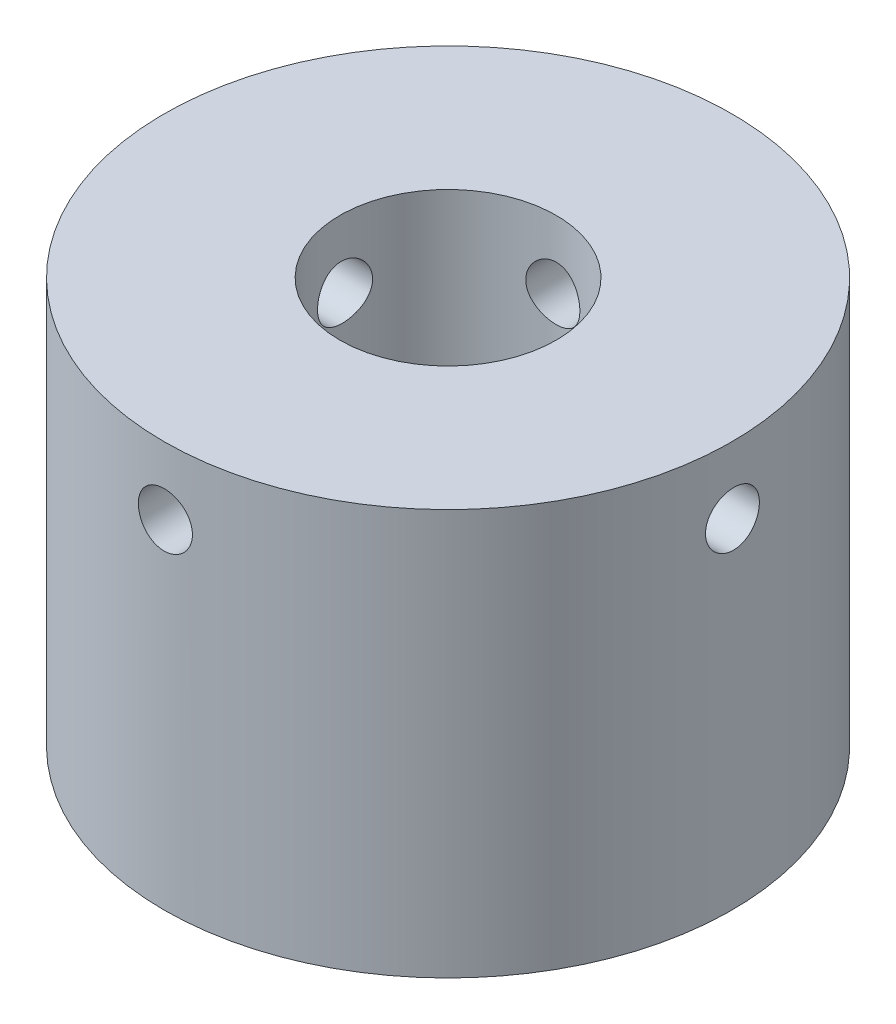
from build123d import *

# Parameters (mm, degrees)
CROQUIS1_R                 = 10.5
CROQUIS1_R_2               = 4
SALIENTE_EXTRUIR1_DEPTH    = 15
CORTAR_EXTRUIR1_DEPTH      = 15
CORTAR_EXTRUIR1_DEPTH_BACK = 15
CROQUIS2_R                 = 1
CORTAR_EXTRUIR2_DEPTH      = 15
CORTAR_EXTRUIR2_DEPTH_BACK = 15
CROQUIS3_R                 = 1.002014624


with BuildPart() as part:
    # Croquis1 → Saliente-Extruir1 (new body)
    with BuildSketch(Plane(origin=(0, 0, 0), x_dir=(1, 0, 0), z_dir=(0, 1, 0))):
        Circle(CROQUIS1_R)
        Circle(CROQUIS1_R_2, mode=Mode.SUBTRACT)
    extrude(amount=SALIENTE_EXTRUIR1_DEPTH)

    # Croquis2 → Cortar-Extruir1 (cut, two sides: drawn at the far end of the back side and taken through both)
    with BuildSketch(Plane.XY.offset(-CORTAR_EXTRUIR1_DEPTH_BACK)):
        with Locations((0, 12.5)):
            Circle(CROQUIS2_R)
    extrude(amount=CORTAR_EXTRUIR1_DEPTH + CORTAR_EXTRUIR1_DEPTH_BACK, mode=Mode.SUBTRACT)

    # Croquis3 → Cortar-Extruir2 (cut, two sides: drawn at the far end of the back side and taken through both)
    with BuildSketch(Plane(origin=(0, 0, 0), x_dir=(0, 0, -1), z_dir=(1, 0, 0)).offset(-CORTAR_EXTRUIR2_DEPTH_BACK)):
        with Locations((0.063508327, 12.5)):
            Circle(CROQUIS3_R)
    extrude(amount=CORTAR_EXTRUIR2_DEPTH + CORTAR_EXTRUIR2_DEPTH_BACK, mode=Mode.SUBTRACT)


solid = part.part
